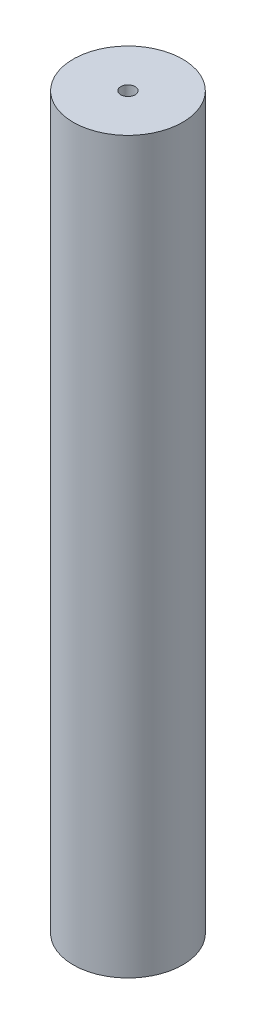
from build123d import *

# Parameters (mm, degrees)
SKETCH1_R                 = 19.05
BOSS_EXTRUDE1_DEPTH       = 127
M6X1_0_TAPPED_HOLE1_D     = 5
M6X1_0_TAPPED_HOLE1_DEPTH = 15
M6X1_0_TAPPED_HOLE1_TIP   = 1.502151548


with BuildPart() as part:
    # Sketch1 → Boss-Extrude1 (new, symmetric)
    with BuildSketch(Plane(origin=(0, 0, 0), x_dir=(1, 0, 0), z_dir=(0, 1, 0))):
        with Locations(Location((0, 0, 0), (0, 0, 270))):
            Circle(SKETCH1_R)
    extrude(amount=BOSS_EXTRUDE1_DEPTH, both=True)

    # M6x1.0 Tapped Hole1
    with Locations(Plane(origin=(0, 127, 0), x_dir=(1, 0, 0), z_dir=(0, 1, 0))):
        with Locations((0, 0)):
            Hole(M6X1_0_TAPPED_HOLE1_D / 2, depth=M6X1_0_TAPPED_HOLE1_DEPTH)
            with Locations((0, 0, -(M6X1_0_TAPPED_HOLE1_DEPTH + M6X1_0_TAPPED_HOLE1_TIP / 2))):  # 118° drill point
                Cone(0, M6X1_0_TAPPED_HOLE1_D / 2, M6X1_0_TAPPED_HOLE1_TIP, mode=Mode.SUBTRACT)


solid = part.part
